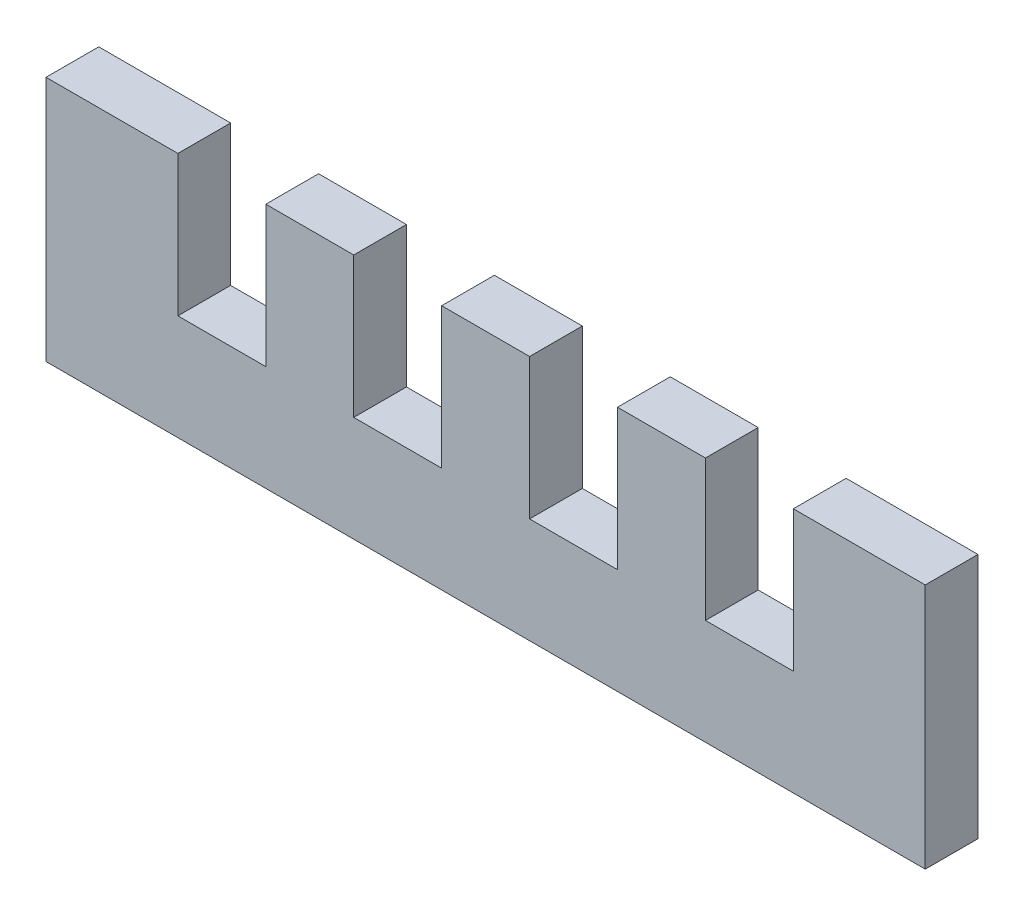
from build123d import *

# Parameters (mm, degrees)
BOSS_EXTRUDE1_DEPTH = 3


with BuildPart() as part:
    # Sketch1 → Boss-Extrude1 (new body)
    with BuildSketch(Plane.XY):
        Polygon((17.5, 14), (25, 14), (25, 0), (-25, 0), (-25, 14), (-17.5, 14), (-17.5, 6), (-12.5, 6), (-12.5, 14), (-7.5, 14), (-7.5, 6), (-2.5, 6), (-2.5, 14), (2.5, 14), (2.5, 6), (7.5, 6), (7.5, 14), (12.5, 14), (12.5, 6), (17.5, 6), align=None)
    extrude(amount=BOSS_EXTRUDE1_DEPTH)


solid = part.part
